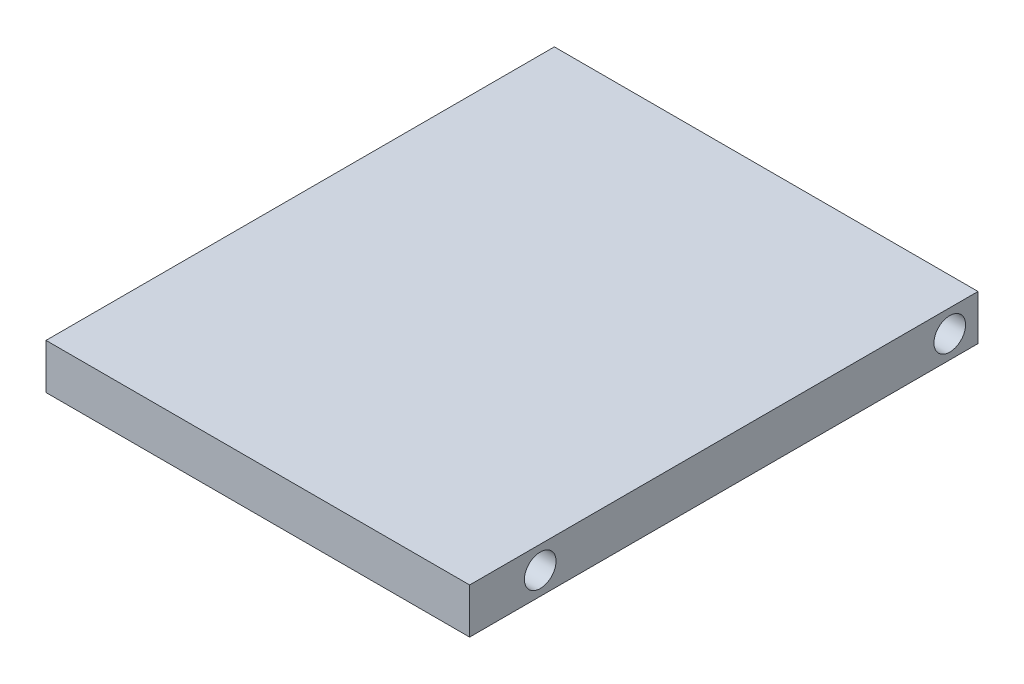
from build123d import *

# Parameters (mm, degrees)
SKETCH1_W           = 75
SKETCH1_H           = 90
BOSS_EXTRUDE1_DEPTH = 8
SKETCH2_R           = 2.8
CUT_EXTRUDE1_DEPTH  = 4.9


with BuildPart() as part:
    # Sketch1 → Boss-Extrude1 (new body)
    with BuildSketch(Plane(origin=(0, 0, 0), x_dir=(1, 0, 0), z_dir=(0, 1, 0))):
        Rectangle(SKETCH1_W, SKETCH1_H)
    extrude(amount=BOSS_EXTRUDE1_DEPTH)

    # Sketch2 → Cut-Extrude1 (cut)
    with BuildSketch(Plane(origin=(37.5, 0, 0), x_dir=(0, 0, -1), z_dir=(1, 0, 0))):
        with Locations((40, 4)):
            Circle(SKETCH2_R)
        with Locations((-32.5, 4)):
            Circle(SKETCH2_R)
    cut_extrude1 = extrude(amount=-CUT_EXTRUDE1_DEPTH, mode=Mode.SUBTRACT)

    # Mirror1: Cut-Extrude1 across plane
    add(cut_extrude1.mirror(Plane(origin=(0, 0, 0), x_dir=(0, 0, 1), z_dir=(1, 0, 0))), mode=Mode.SUBTRACT)


solid = part.part
